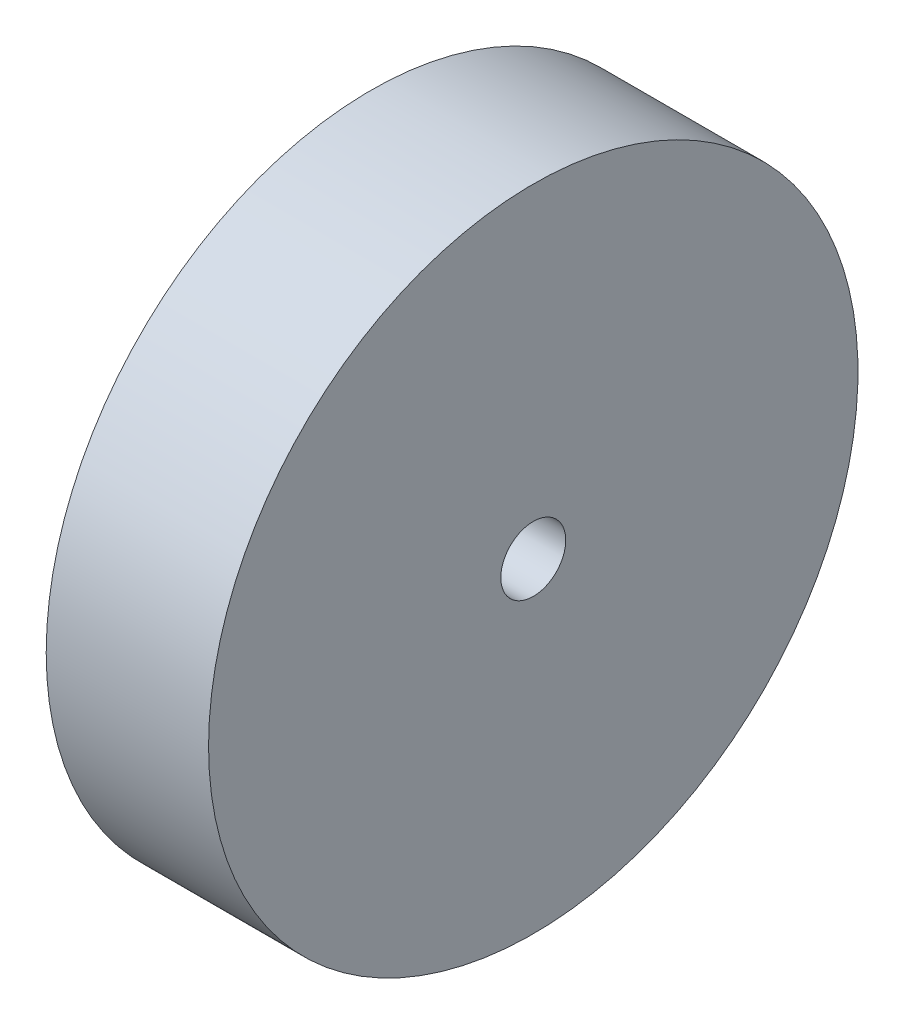
from build123d import *

# Parameters (mm, degrees)
SKETCH1_W = 5
SKETCH1_H = 9


with BuildPart() as part:
    # Sketch1 → Revolve1 (revolve)
    with BuildSketch(Plane.XY, mode=Mode.PRIVATE) as revolve1_sk:
        with Locations((0, 5.5)):
            Rectangle(SKETCH1_W, SKETCH1_H)
    revolve(revolve1_sk.sketch.rotate(Axis((0, 0, 0), (1, 0, 0)), 90), axis=Axis((0, 0, 0), (1, 0, 0)))


solid = part.part
